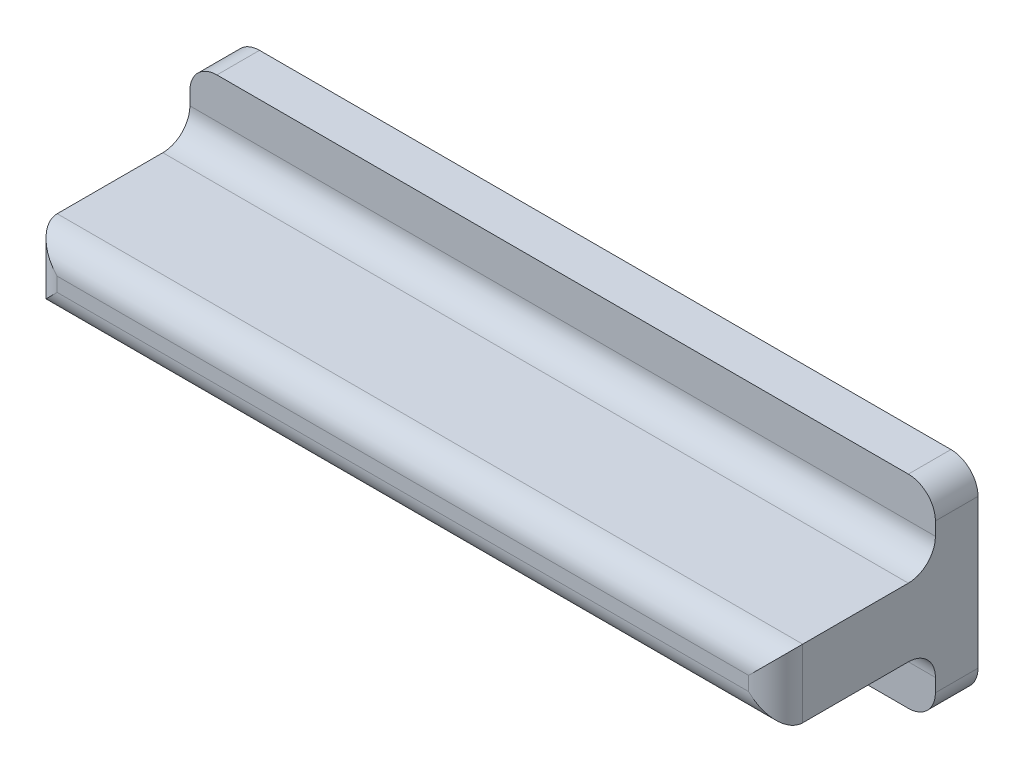
from build123d import *

# Parameters (mm, degrees)
SKETCH1_W           = 70
SKETCH1_H           = 19.05
BOSS_EXTRUDE1_DEPTH = 4
SKETCH2_W           = 70
SKETCH2_H           = 6.398717948
BOSS_EXTRUDE2_DEPTH = 15
FILLET1_R           = 2.54


with BuildPart() as part:
    # Sketch1 → Boss-Extrude1 (new body)
    with BuildSketch(Plane.XY):
        Rectangle(SKETCH1_W, SKETCH1_H)
    extrude(amount=BOSS_EXTRUDE1_DEPTH)

    # Sketch2 → Boss-Extrude2 (add)
    with BuildSketch(Plane.XY.offset(4)):
        Rectangle(SKETCH2_W, SKETCH2_H)
    extrude(amount=BOSS_EXTRUDE2_DEPTH)

    # Fillet1
    fillet1_edges = [part.edges().sort_by_distance(p)[0] for p in [
        (0, 3.199358974, 4),
        (0, -3.199358974, 4),
        (35, 0, 19),
        (0, 3.199358974, 19),
        (-35, 0, 19),
        (0, -3.199358974, 19),
        (35, -9.525, 2),
        (-35, -9.525, 2),
        (-35, 9.525, 2),
        (35, 9.525, 2),
    ]]
    fillet(fillet1_edges, radius=FILLET1_R)


solid = part.part
